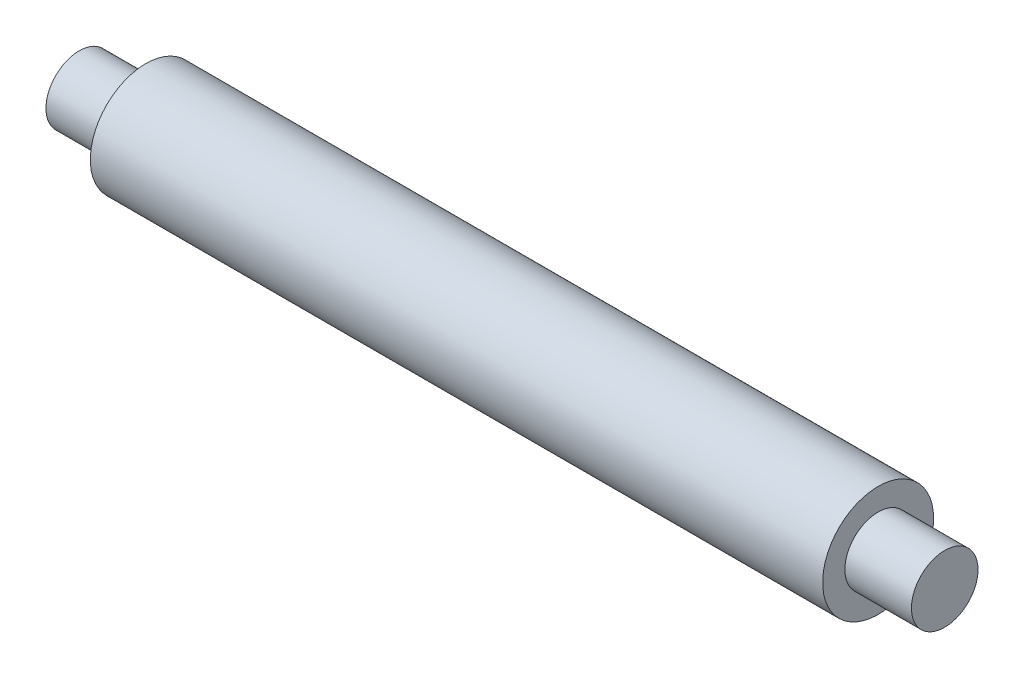
from build123d import *


with BuildPart() as part:
    # Sketch1 → Revolve1 (revolve)
    with BuildSketch(Plane.XY, mode=Mode.PRIVATE) as revolve1_sk:
        Polygon((-19.5, 0), (-19.5, 1.5), (-16.5, 1.5), (-16.5, 2.5), (16.5, 2.5), (16.5, 1.5), (19.5, 1.5), (19.5, 0), align=None)
    revolve(revolve1_sk.sketch.rotate(Axis((19.5, 0, 0), (-1, 0, 0)), 90), axis=Axis((19.5, 0, 0), (-1, 0, 0)))


solid = part.part
